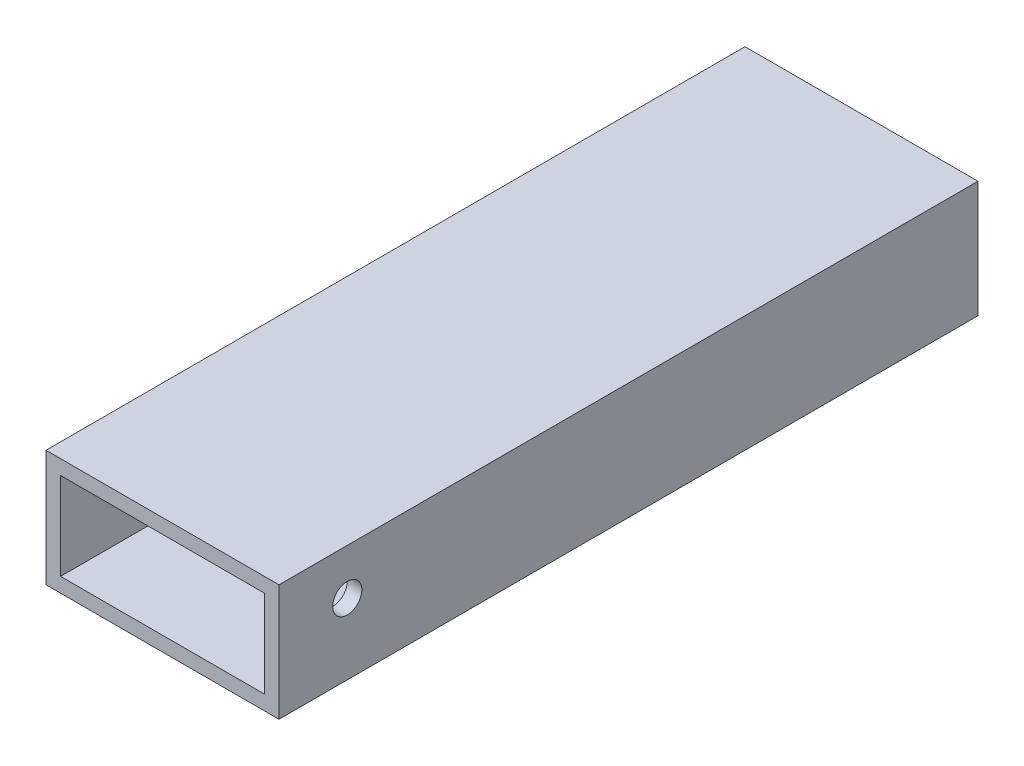
from build123d import *

# Parameters (mm, degrees)
SKETCH1_W           = 50.8
SKETCH1_H           = 25.4
SKETCH1_W_2         = 44.45
SKETCH1_H_2         = 19.05
BOSS_EXTRUDE1_DEPTH = 152.4
SKETCH2_R           = 3.175
CUT_EXTRUDE1_DEPTH  = 162.144934764


with BuildPart() as part:
    # Sketch1 → Boss-Extrude1 (new body)
    with BuildSketch(Plane.XY):
        Rectangle(SKETCH1_W, SKETCH1_H)
        Rectangle(SKETCH1_W_2, SKETCH1_H_2, mode=Mode.SUBTRACT)
    extrude(amount=BOSS_EXTRUDE1_DEPTH)

    # Sketch2 → Cut-Extrude1 (cut, through all)
    with BuildSketch(Plane(origin=(25.4, 0, 0), x_dir=(0, 0, -1), z_dir=(1, 0, 0))):
        with Locations((-137.513740162, 2.738654121)):
            Circle(SKETCH2_R)
    extrude(amount=-CUT_EXTRUDE1_DEPTH, mode=Mode.SUBTRACT)


solid = part.part
